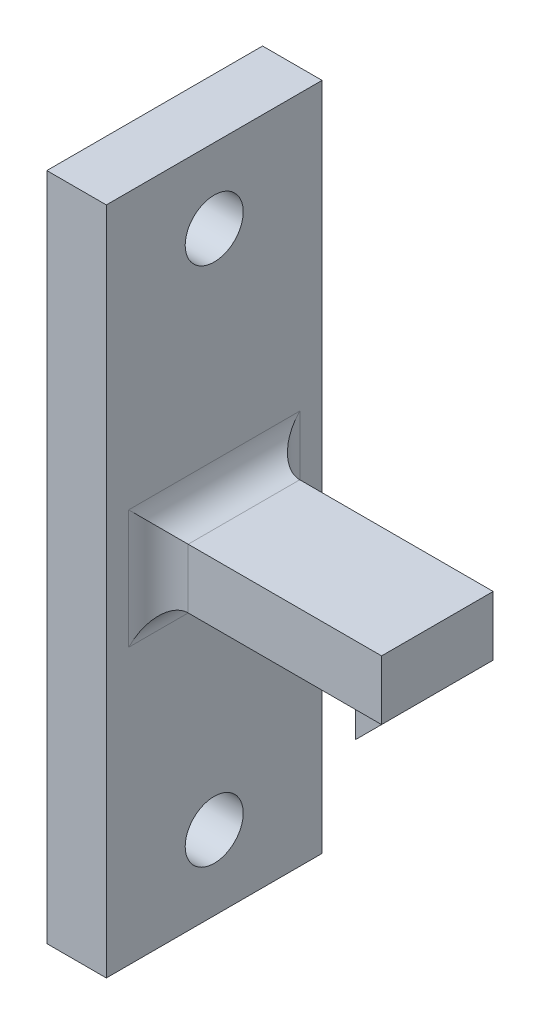
from build123d import *

# Parameters (mm, degrees)
BOSS_EXTRUDE1_DEPTH      = 1
BOSS_EXTRUDE1_DEPTH_BACK = 1
SKETCH2_R                = 2
SKETCH2_R_2              = 1
BOSS_EXTRUDE2_DEPTH      = 4
SKETCH4_R                = 1.07
CUT_EXTRUDE1_DEPTH       = 233.583689314
BOSS_EXTRUDE3_DEPTH      = 2
SKETCH8_W                = 4
SKETCH8_H                = 8
BOSS_EXTRUDE4_DEPTH      = 2
CUT_EXTRUDE2_DEPTH       = 2
SKETCH10_W               = 16.5
SKETCH10_H               = 4
BOSS_EXTRUDE5_DEPTH      = 2.75
SKETCH11_W               = 16.5
SKETCH11_H               = 4
BOSS_EXTRUDE6_DEPTH      = 2.75
BOSS_EXTRUDE7_DEPTH      = 0.5
BOSS_EXTRUDE8_DEPTH      = 0.5
SKETCH14_W               = 1.779922348
SKETCH14_H               = 4
BOSS_EXTRUDE9_DEPTH      = 7.5
CUT_EXTRUDE3_DEPTH       = 10
CUT_EXTRUDE3_DEPTH_BACK  = 2
SKETCH15_W               = 40
SKETCH15_H               = 27.31360861
SKETCH16_W               = 14.5
SKETCH16_H               = 45
BOSS_EXTRUDE10_DEPTH     = 4
SKETCH18_R               = 1.95
CUT_EXTRUDE4_DEPTH       = 4
FILLET1_R                = 2


with BuildPart() as part:
    # Sketch2 → Boss-Extrude1 (new, two sides: drawn at the far end of the back side and taken through both)
    # profile 1 of 2: a face of its own
    with BuildSketch(Plane.XY.offset(-2.5).offset(-BOSS_EXTRUDE1_DEPTH_BACK)):
        with BuildLine():
            ThreePointArc((230.02407749, -2), (228.02407749, 0), (230.02407749, 2))
            Line((230.02407749, 2), (225.02407749, 2))
            Line((225.02407749, 2), (225.02407749, -2))
            Line((225.02407749, -2), (230.02407749, -2))
        make_face()
    # profile 2 of 2: a face of its own
    with BuildSketch(Plane.XY.offset(-2.5).offset(-BOSS_EXTRUDE1_DEPTH_BACK)):
        with Locations((230.02407749, 0)):
            Circle(SKETCH2_R)
        with Locations((230.02407749, 0)):
            Circle(SKETCH2_R_2, mode=Mode.SUBTRACT)
    extrude(amount=BOSS_EXTRUDE1_DEPTH + BOSS_EXTRUDE1_DEPTH_BACK)

    # Sketch3 → Boss-Extrude2 (add)
    with BuildSketch(Plane(origin=(0, 2, 0), x_dir=(1, 0, 0), z_dir=(0, 1, 0))):
        Polygon((223.02407749, 2.5), (225.02407749, 2.5), (225.02407749, 3.5), (222.02407749, 10.5), (216.095506061, 10.5), (216.095506061, 8.5), (221.095506061, 8.5), (223.02407749, 4), align=None)
        Polygon((222.02407749, -5.5), (225.02407749, 1.5), (225.02407749, 2.5), (223.02407749, 2.5), (223.02407749, 1), (221.095506061, -3.5), (216.095506061, -3.5), (216.095506061, -5.5), align=None)
    extrude(amount=-BOSS_EXTRUDE2_DEPTH)

    # Sketch4 → Cut-Extrude1 (cut, through all)
    with BuildSketch(Plane(origin=(0, 0, -10.5), x_dir=(-1, 0, 0), z_dir=(0, 0, -1))):
        with Locations((-218.095506061, 0)):
            Circle(SKETCH4_R)
    extrude(amount=-CUT_EXTRUDE1_DEPTH, mode=Mode.SUBTRACT)

    # Sketch6 → Boss-Extrude3 (add)
    with BuildSketch(Plane.XY.offset(-1.5)):
        Polygon((230.02407749, 2), (240.02407749, 2), (240.02407749, -2), (230.02407749, -2), (228.102487775, -2), (228.102487775, 2), align=None)
    extrude(amount=-BOSS_EXTRUDE3_DEPTH)

    # Sketch8 → Boss-Extrude4 (add)
    with BuildSketch(Plane(origin=(0, 0, -3.5), x_dir=(-1, 0, 0), z_dir=(0, 0, -1))):
        with Locations((-238.02407749, -2)):
            Rectangle(SKETCH8_W, SKETCH8_H)
    extrude(amount=-BOSS_EXTRUDE4_DEPTH)

    # Sketch9 → Cut-Extrude2 (cut)
    with BuildSketch(Plane(origin=(0, 0, -3.5), x_dir=(-1, 0, 0), z_dir=(0, 0, -1))):
        Polygon((-236.02407749, -6), (-240.02407749, -6), (-240.02407749, -2), align=None)
    extrude(amount=-CUT_EXTRUDE2_DEPTH, mode=Mode.SUBTRACT)

    # Sketch10 → Boss-Extrude5 (add)
    with BuildSketch(Plane(origin=(0, 0, -3.5), x_dir=(-1, 0, 0), z_dir=(0, 0, -1))):
        with Locations((-231.77407749, 0)):
            Rectangle(SKETCH10_W, SKETCH10_H)
    extrude(amount=BOSS_EXTRUDE5_DEPTH)

    # Sketch11 → Boss-Extrude6 (add)
    with BuildSketch(Plane.XY.offset(-1.5)):
        with Locations((231.77407749, 0)):
            Rectangle(SKETCH11_W, SKETCH11_H)
    extrude(amount=BOSS_EXTRUDE6_DEPTH)

    # Sketch12 → Boss-Extrude7 (add)
    with BuildSketch(Plane(origin=(0, 0, -3.5), x_dir=(-1, 0, 0), z_dir=(0, 0, -1))):
        Polygon((-240.02407749, -2), (-236.02407749, -6), (-236.02407749, -2), align=None)
    extrude(amount=BOSS_EXTRUDE7_DEPTH)

    # Sketch13 → Boss-Extrude8 (add)
    with BuildSketch(Plane.XY.offset(-1.5)):
        Polygon((236.02407749, -2), (236.02407749, -6), (240.02407749, -2), align=None)
    extrude(amount=BOSS_EXTRUDE8_DEPTH)

    # Sketch14 → Boss-Extrude9 (add)
    with BuildSketch(Plane(origin=(0, 0, -6.25), x_dir=(-1, 0, 0), z_dir=(0, 0, -1))):
        with Locations((-223.914038664, 0)):
            Rectangle(SKETCH14_W, SKETCH14_H)
    extrude(amount=-BOSS_EXTRUDE9_DEPTH)

    # Sketch15 → Cut-Extrude3 (cut, two sides: drawn at the far end of the back side and taken through both)
    with BuildSketch(Plane.ZY.offset(-223.02407749).offset(-CUT_EXTRUDE3_DEPTH_BACK)):
        with Locations((-2.5, 0)):
            Rectangle(SKETCH15_W, SKETCH15_H)
    extrude(amount=CUT_EXTRUDE3_DEPTH + CUT_EXTRUDE3_DEPTH_BACK, mode=Mode.SUBTRACT)

    # Sketch16 → Boss-Extrude10 (add)
    with BuildSketch(Plane.ZY.offset(-225.02407749)):
        with Locations((-2.5, 0)):
            Rectangle(SKETCH16_W, SKETCH16_H)
    extrude(amount=BOSS_EXTRUDE10_DEPTH)

    # Sketch18 → Cut-Extrude4 (cut)
    with BuildSketch(Plane.ZY.offset(-221.02407749)):
        with Locations((-2.5, 17.5)):
            Circle(SKETCH18_R)
        with Locations((-2.5, -17.5)):
            Circle(SKETCH18_R)
    extrude(amount=-CUT_EXTRUDE4_DEPTH, mode=Mode.SUBTRACT)

    # Fillet1
    fillet1_edges = [part.edges().sort_by_distance(p)[0] for p in [
        (225.02407749, 0, 1.25),
        (225.02407749, 0, -6.25),
        (225.02407749, -2, -2.5),
        (225.02407749, 2, -2.5),
    ]]
    fillet(fillet1_edges, radius=FILLET1_R)


solid = part.part
